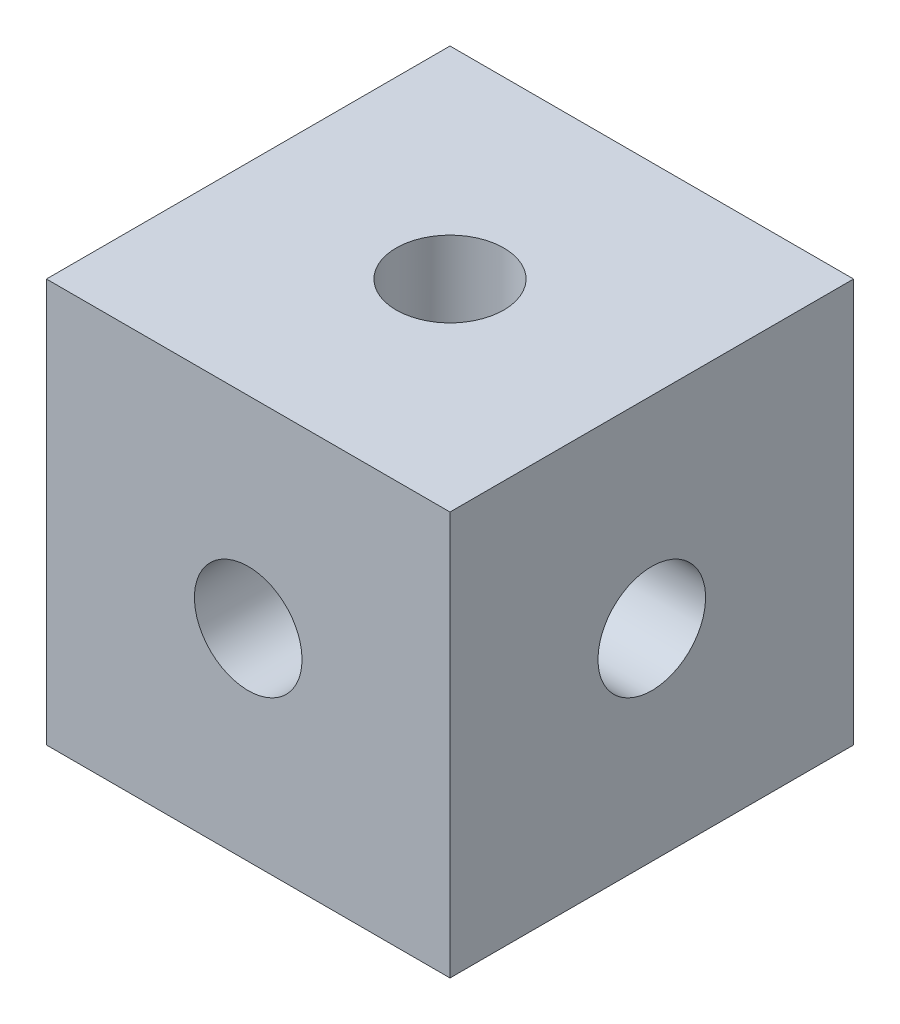
from build123d import *

# Parameters (mm, degrees)
SKETCH_1_W          = 15
SKETCH_1_H          = 15
SKETCH_1_R          = 2
EXTRUDE_1_DEPTH     = 15
SKETCH_2_R          = 2
CUT_EXTRUDE_1_DEPTH = 15
SKETCH_3_R          = 2
CUT_EXTRUDE_2_DEPTH = 15


with BuildPart() as part:
    # 草图1 → 凸台-拉伸1 (new body)
    with BuildSketch(Plane(origin=(0, 0, 0), x_dir=(1, 0, 0), z_dir=(0, 1, 0))):
        Rectangle(SKETCH_1_W, SKETCH_1_H)
        with Locations(Location((0, 0, 0), (0, 0, 270))):
            Circle(SKETCH_1_R, mode=Mode.SUBTRACT)
    extrude(amount=EXTRUDE_1_DEPTH)

    # 草图2 → 切除-拉伸1 (cut)
    with BuildSketch(Plane.XY.offset(7.5)):
        with Locations((0, 7.5)):
            Circle(SKETCH_2_R)
    extrude(amount=-CUT_EXTRUDE_1_DEPTH, mode=Mode.SUBTRACT)

    # 草图3 → 切除-拉伸2 (cut)
    with BuildSketch(Plane.ZY.offset(7.5)):
        with Locations((0, 7.5)):
            Circle(SKETCH_3_R)
    extrude(amount=-CUT_EXTRUDE_2_DEPTH, mode=Mode.SUBTRACT)


solid = part.part
